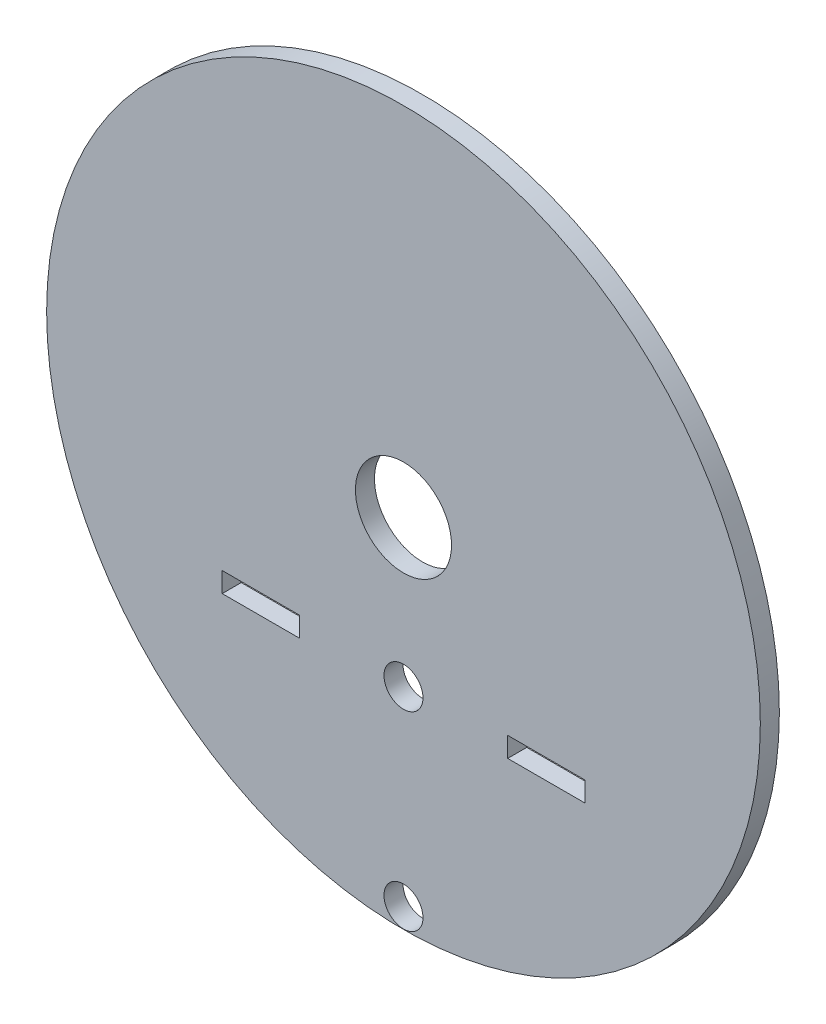
from build123d import *

# Parameters (mm, degrees)
SKETCH_1_R      = 37.5
SKETCH_1_R_2    = 2.05
SKETCH_1_R_3    = 5.05
SKETCH_1_W      = 8.1
SKETCH_1_H      = 2.1
EXTRUDE_1_DEPTH = 2


with BuildPart() as part:
    # 草图1 → 凸台-拉伸1 (new body)
    with BuildSketch(Plane.XY):
        with Locations((0, 35.4)):
            Circle(SKETCH_1_R)
        Circle(SKETCH_1_R_2, mode=Mode.SUBTRACT)
        with Locations((0, 20)):
            Circle(SKETCH_1_R_2, mode=Mode.SUBTRACT)
        with Locations((0, 35.4)):
            Circle(SKETCH_1_R_3, mode=Mode.SUBTRACT)
        with Locations((-15, 20)):
            Rectangle(SKETCH_1_W, SKETCH_1_H, mode=Mode.SUBTRACT)
        with Locations((15, 20)):
            Rectangle(SKETCH_1_W, SKETCH_1_H, mode=Mode.SUBTRACT)
    extrude(amount=EXTRUDE_1_DEPTH)


solid = part.part
